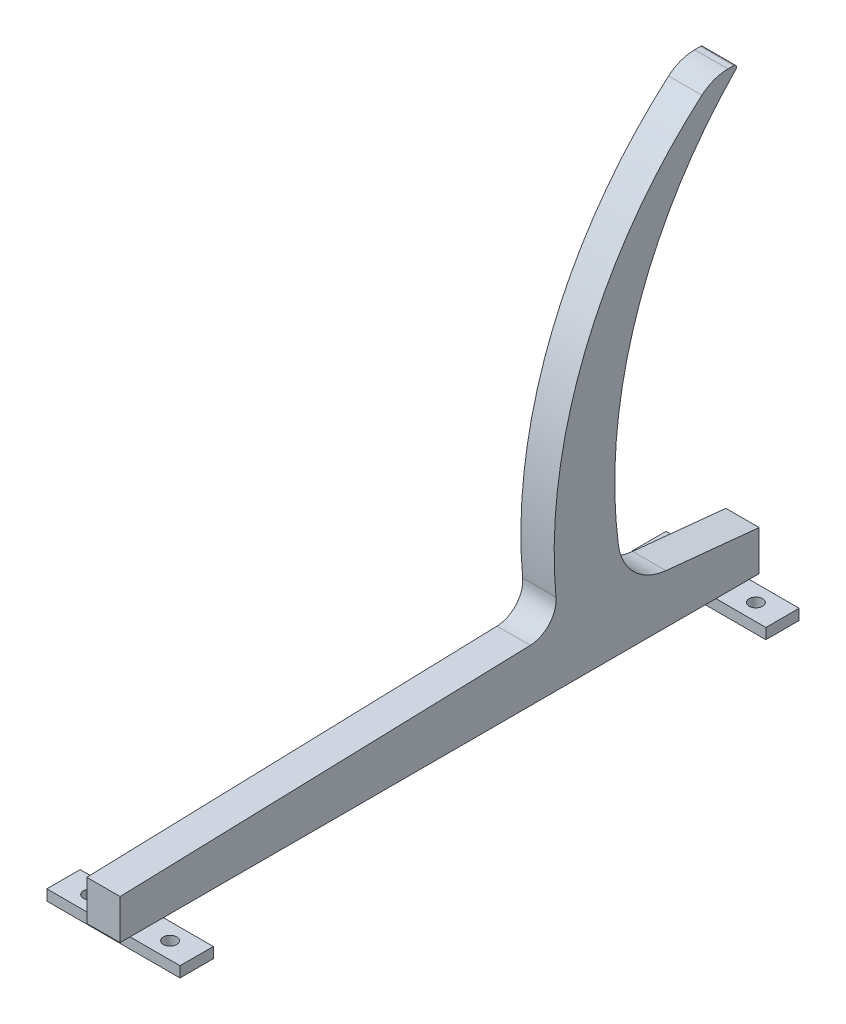
from build123d import *

# Parameters (mm, degrees)
BOSS_EXTRUDE1_DEPTH = 15.875
FILLET1_R           = 38.1
FILLET2_R           = 50.8
SKETCH2_W           = 127
SKETCH2_H           = 31.75
SKETCH2_R           = 6.35
BOSS_EXTRUDE2_DEPTH = 10.16
FILLET3_R           = 2.54


with BuildPart() as part:
    # Sketch1 → Boss-Extrude1 (new, symmetric)
    with BuildSketch(Plane(origin=(0, 0, 0), x_dir=(0, 0, -1), z_dir=(1, 0, 0))):
        with BuildLine():
            Line((-304.8, 0), (304.8, 0))
            Line((304.8, 0), (304.8, 38.1))
            Line((304.8, 38.1), (177.8, 50.8))
            ThreePointArc((177.8, 50.8), (182.64153721, 255.463845718), (286.642935854, 431.8))
            Line((286.642935854, 431.8), (261.242935854, 431.8))
            ThreePointArc((261.242935854, 431.8), (141.525824012, 273.647129076), (110.92514038, 77.667243347))
            ThreePointArc((110.92514038, 77.667243347), (104.653146696, 58.510068346), (86.40105547, 49.954577438))
            Line((86.40105547, 49.954577438), (-304.8, 38.1))
            Line((-304.8, 38.1), (-304.8, 0))
        make_face()
    extrude(amount=BOSS_EXTRUDE1_DEPTH, both=True)

    # Fillet1
    fillet1_edges = [part.edges().sort_by_distance(p)[0] for p in [
        (0, 431.8, -261.242935854),
    ]]
    fillet(fillet1_edges, radius=FILLET1_R)

    # Fillet2
    fillet2_edges = [part.edges().sort_by_distance(p)[0] for p in [
        (0, 50.8, -177.8),
    ]]
    fillet(fillet2_edges, radius=FILLET2_R)

    # Sketch2 → Boss-Extrude2 (add)
    # profile 1 of 2: a face of its own
    with BuildSketch(Plane.XZ):
        with Locations((0, 279.4)):
            Rectangle(SKETCH2_W, SKETCH2_H)
        with Locations(Location((-38.1, 279.4, 0), (0, 0, 270))):
            Circle(SKETCH2_R, mode=Mode.SUBTRACT)
        with Locations(Location((38.1, 279.4, 0), (0, 0, 270))):
            Circle(SKETCH2_R, mode=Mode.SUBTRACT)
    # profile 2 of 2: a face of its own
    with BuildSketch(Plane.XZ):
        with Locations((0, -279.4)):
            Rectangle(SKETCH2_W, SKETCH2_H)
        with Locations(Location((38.1, -279.4, 0), (0, 0, 90))):
            Circle(SKETCH2_R, mode=Mode.SUBTRACT)
        with Locations(Location((-38.1, -279.4, 0), (0, 0, 90))):
            Circle(SKETCH2_R, mode=Mode.SUBTRACT)
    extrude(amount=BOSS_EXTRUDE2_DEPTH)

    # Fillet3
    fillet3_edges = [part.edges().sort_by_distance(p)[0] for p in [
        (0, 431.8, -286.642935854),
    ]]
    fillet(fillet3_edges, radius=FILLET3_R)


solid = part.part
